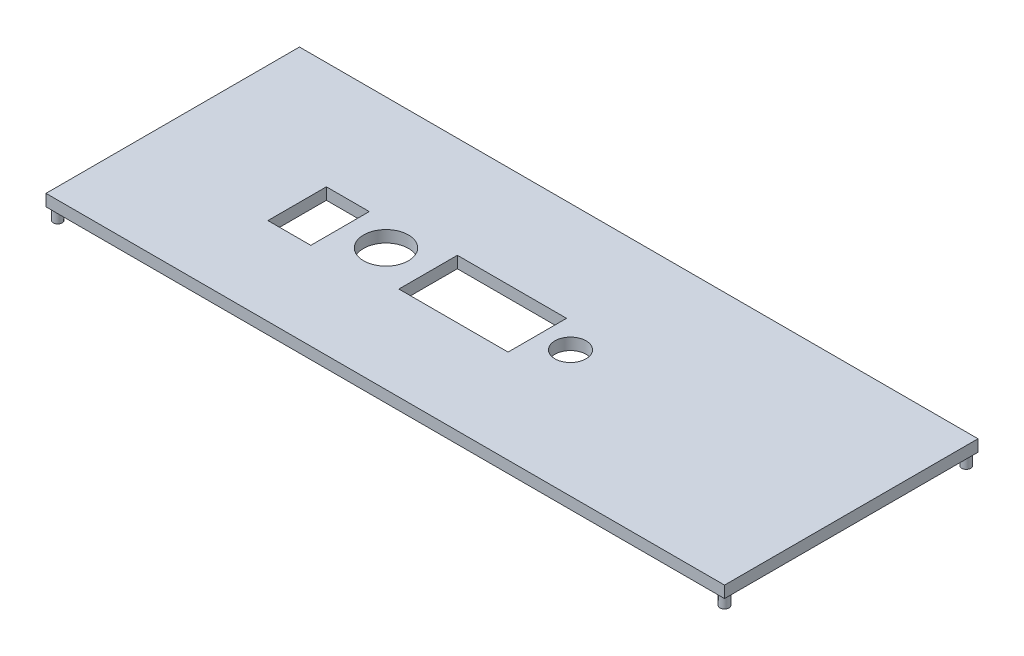
from build123d import *

# Parameters (mm, degrees)
SKETCH1_W           = 174
SKETCH1_H           = 65
BOSS_EXTRUDE1_DEPTH = 3
SKETCH2_R           = 4
SKETCH2_R_2         = 5.75
SKETCH2_W           = 28
SKETCH2_H           = 15
SKETCH2_W_2         = 11
CUT_EXTRUDE1_DEPTH  = 3
SKETCH3_R           = 1.15
BOSS_EXTRUDE2_DEPTH = 3


with BuildPart() as part:
    # Sketch1 → Boss-Extrude1 (new body)
    with BuildSketch(Plane(origin=(0, 0, 0), x_dir=(1, 0, 0), z_dir=(0, 1, 0))):
        Rectangle(SKETCH1_W, SKETCH1_H)
    extrude(amount=BOSS_EXTRUDE1_DEPTH)

    # Sketch2 → Cut-Extrude1 (cut)
    with BuildSketch(Plane(origin=(0, 3, 0), x_dir=(1, 0, 0), z_dir=(0, 1, 0))):
        with Locations(Location((15, 0, 0), (0, 0, 270))):
            Circle(SKETCH2_R)
        with Locations(Location((-31.3, -1.00957594, 0), (0, 0, 270))):
            Circle(SKETCH2_R_2)
        with Locations((-6.5, -1.00957594)):
            Rectangle(SKETCH2_W, SKETCH2_H)
        with Locations((-47, -2.596032883)):
            Rectangle(SKETCH2_W_2, SKETCH2_H)
    extrude(amount=-CUT_EXTRUDE1_DEPTH, mode=Mode.SUBTRACT)

    # Sketch3 → Boss-Extrude2 (add)
    with BuildSketch(Plane.XZ):
        with Locations(Location((-85.5, 31, 0), (0, 0, 270))):
            Circle(SKETCH3_R)
        with Locations(Location((85.5, 31, 0), (0, 0, 270))):
            Circle(SKETCH3_R)
        with Locations(Location((85.5, -31, 0), (0, 0, 270))):
            Circle(SKETCH3_R)
        with Locations(Location((-85.5, -31, 0), (0, 0, 270))):
            Circle(SKETCH3_R)
    extrude(amount=BOSS_EXTRUDE2_DEPTH)


solid = part.part
